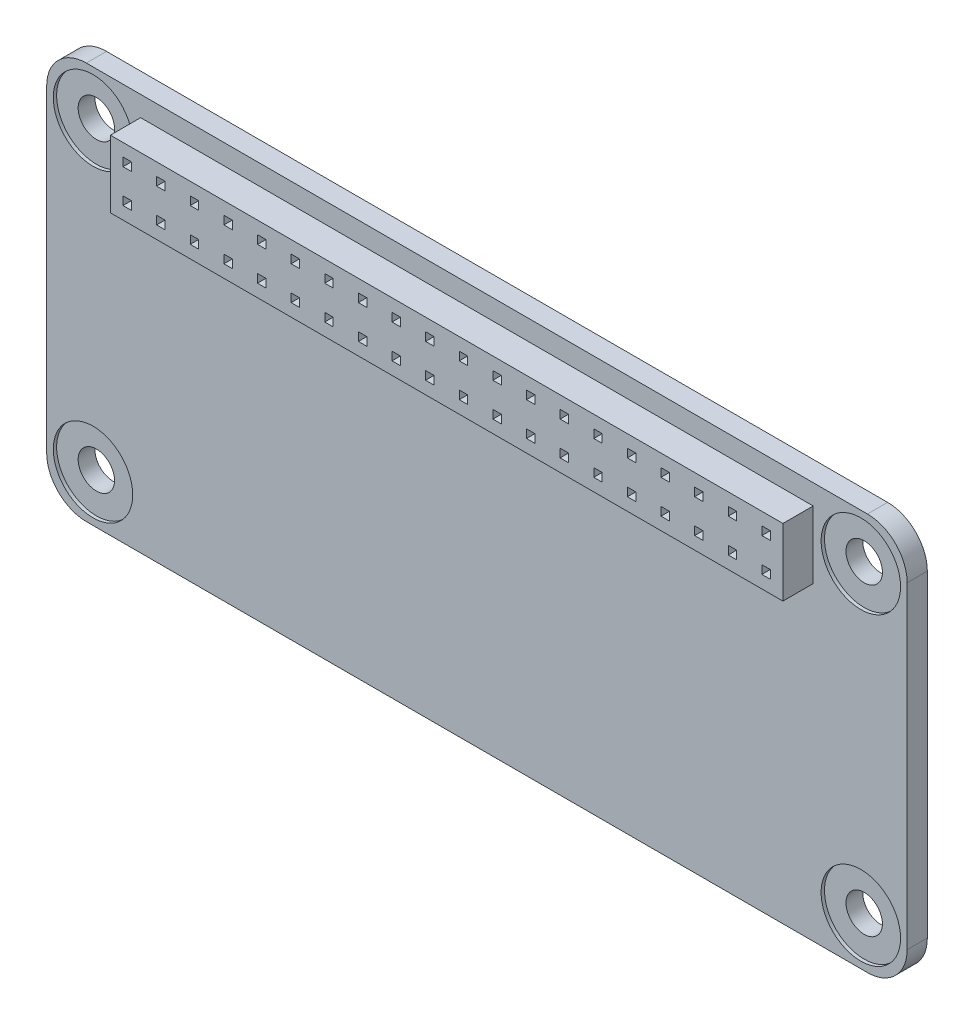
from build123d import *

# Parameters (mm, degrees)
SKETCH1_W           = 65
SKETCH1_H           = 30
BOSS_EXTRUDE1_DEPTH = 1.524
FILLET1_R           = 3
SKETCH2_R           = 1.375
CUT_EXTRUDE1_DEPTH  = 72.605325053
SKETCH3_R           = 3
CUT_EXTRUDE2_DEPTH  = 0.254
SKETCH8_W           = 50.8
SKETCH8_H           = 5.08
BOSS_EXTRUDE8_DEPTH = 2.286
SKETCH9_W           = 0.635
SKETCH9_H           = 0.635
CUT_EXTRUDE3_DEPTH  = 72.690418467
LPATTERN1_COUNT     = 20
LPATTERN1_PITCH     = 2.54


with BuildPart() as part:
    # Sketch1 → Boss-Extrude1 (new body)
    with BuildSketch(Plane.XY):
        with Locations((32.5, 15)):
            Rectangle(SKETCH1_W, SKETCH1_H)
    extrude(amount=BOSS_EXTRUDE1_DEPTH)

    # Fillet1
    fillet1_edges = [part.edges().sort_by_distance(p)[0] for p in [
        (0, 30, 0.762),
        (65, 30, 0.762),
        (65, 0, 0.762),
        (0, 0, 0.762),
    ]]
    fillet(fillet1_edges, radius=FILLET1_R)

    # Sketch2 → Cut-Extrude1 (cut, through all)
    with BuildSketch(Plane.XY.offset(1.524)):
        with Locations((3.5, 26.5)):
            Circle(SKETCH2_R)
        with Locations((61.5, 26.5)):
            Circle(SKETCH2_R)
        with Locations((61.5, 3.5)):
            Circle(SKETCH2_R)
        with Locations((3.5, 3.5)):
            Circle(SKETCH2_R)
    extrude(amount=-CUT_EXTRUDE1_DEPTH, mode=Mode.SUBTRACT)

    # Sketch3 → Cut-Extrude2 (cut)
    with BuildSketch(Plane.XY.offset(1.524)):
        with Locations((3.5, 26.5)):
            Circle(SKETCH3_R)
        with Locations((61.5, 26.5)):
            Circle(SKETCH3_R)
        with Locations((61.5, 3.5)):
            Circle(SKETCH3_R)
        with Locations((3.5, 3.5)):
            Circle(SKETCH3_R)
    extrude(amount=-CUT_EXTRUDE2_DEPTH, mode=Mode.SUBTRACT)

    # Sketch8 → Boss-Extrude8 (add)
    with BuildSketch(Plane.XY.offset(1.524)):
        with Locations((32.5, 25.936)):
            Rectangle(SKETCH8_W, SKETCH8_H)
    extrude(amount=BOSS_EXTRUDE8_DEPTH)

    # Sketch9 → Cut-Extrude3 (cut, through all)
    with BuildSketch(Plane.XY.offset(3.81)):
        with Locations((8.37, 27.206)):
            Rectangle(SKETCH9_W, SKETCH9_H)
        with Locations((8.37, 24.666)):
            Rectangle(SKETCH9_W, SKETCH9_H)
    cut_extrude3 = extrude(amount=-CUT_EXTRUDE3_DEPTH, mode=Mode.SUBTRACT)

    # LPattern1: Cut-Extrude3 ×20
    with Locations(*[(i * LPATTERN1_PITCH, 0, 0) for i in range(1, LPATTERN1_COUNT)]):
        add(cut_extrude3, mode=Mode.SUBTRACT)


solid = part.part
